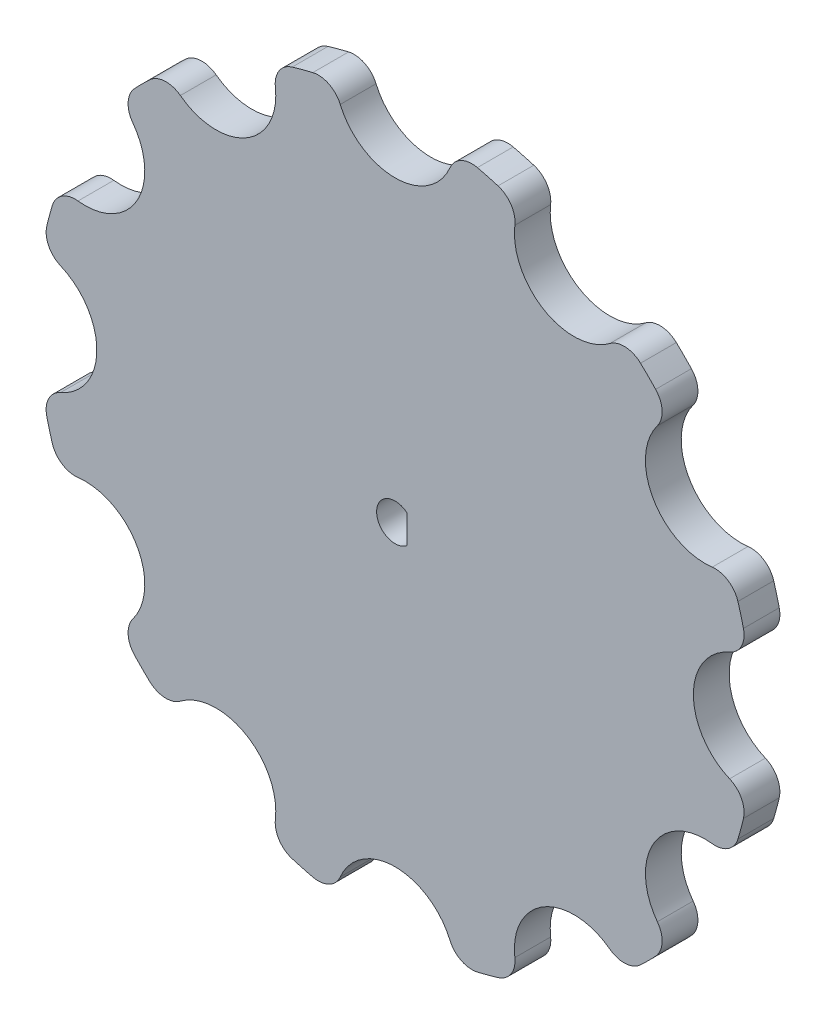
from build123d import *

# Parameters (mm, degrees)
BOSS_EXTRUDE1_DEPTH = 3
FILLET1_R           = 2
FILLET2_R           = 2
CUT_EXTRUDE1_DEPTH  = 10


with BuildPart() as part:
    # Sketch1 → Boss-Extrude1 (new body)
    with BuildSketch(Plane.XY):
        with BuildLine():
            ThreePointArc((29.583333333, -4.982608643), (25, 0), (29.583333333, 4.982608643))
            ThreePointArc((29.583333333, 4.982608643), (28.977774789, 7.764571353), (28.111222517, 10.476601005))
            ThreePointArc((28.111222517, 10.476601005), (21.650635095, 12.5), (23.128613874, 19.106732329))
            ThreePointArc((23.128613874, 19.106732329), (21.213203436, 21.213203436), (19.106732329, 23.128613874))
            ThreePointArc((19.106732329, 23.128613874), (12.5, 21.650635095), (10.476601005, 28.111222517))
            ThreePointArc((10.476601005, 28.111222517), (7.764571353, 28.977774789), (4.982608643, 29.583333333))
            ThreePointArc((4.982608643, 29.583333333), (0, 25), (-4.982608643, 29.583333333))
            ThreePointArc((-4.982608643, 29.583333333), (-7.764571353, 28.977774789), (-10.476601005, 28.111222517))
            ThreePointArc((-10.476601005, 28.111222517), (-10.120604803, 27.072321783), (-10, 25.980762114))
            ThreePointArc((-10, 25.980762114), (-13.505620805, 21.209302083), (-19.106732329, 23.128613874))
            ThreePointArc((-19.106732329, 23.128613874), (-21.213203436, 21.213203436), (-23.128613874, 19.106732329))
            ThreePointArc((-23.128613874, 19.106732329), (-21.550144707, 17.317246081), (-20.980762114, 15))
            ThreePointArc((-20.980762114, 15), (-23.302357926, 10.777897324), (-28.111222517, 10.476601005))
            ThreePointArc((-28.111222517, 10.476601005), (-28.977774789, 7.764571353), (-29.583333333, 4.982608643))
            ThreePointArc((-29.583333333, 4.982608643), (-26.320099639, 3.385016002), (-25, 0))
            ThreePointArc((-25, 0), (-26.320099639, -3.385016002), (-29.583333333, -4.982608643))
            ThreePointArc((-29.583333333, -4.982608643), (-28.977774789, -7.764571353), (-28.111222517, -10.476601005))
            ThreePointArc((-28.111222517, -10.476601005), (-23.302357926, -10.777897324), (-20.980762114, -15))
            ThreePointArc((-20.980762114, -15), (-21.550144707, -17.317246081), (-23.128613874, -19.106732329))
            ThreePointArc((-23.128613874, -19.106732329), (-21.213203436, -21.213203436), (-19.106732329, -23.128613874))
            ThreePointArc((-19.106732329, -23.128613874), (-13.505620805, -21.209302083), (-10, -25.980762114))
            ThreePointArc((-10, -25.980762114), (-10.120604803, -27.072321783), (-10.476601005, -28.111222517))
            ThreePointArc((-10.476601005, -28.111222517), (-7.764571353, -28.977774789), (-4.982608643, -29.583333333))
            ThreePointArc((-4.982608643, -29.583333333), (0, -25), (4.982608643, -29.583333333))
            ThreePointArc((4.982608643, -29.583333333), (7.764571353, -28.977774789), (10.476601005, -28.111222517))
            ThreePointArc((10.476601005, -28.111222517), (12.5, -21.650635095), (19.106732329, -23.128613874))
            ThreePointArc((19.106732329, -23.128613874), (21.213203436, -21.213203436), (23.128613874, -19.106732329))
            ThreePointArc((23.128613874, -19.106732329), (21.650635095, -12.5), (28.111222517, -10.476601005))
            ThreePointArc((28.111222517, -10.476601005), (28.977774789, -7.764571353), (29.583333333, -4.982608643))
        make_face()
    extrude(amount=BOSS_EXTRUDE1_DEPTH)

    # Fillet1
    fillet1_edges = [part.edges().sort_by_distance(p)[0] for p in [
        (-10.476601005, 28.111222517, 1.5),
        (-4.982608643, 29.583333333, 1.5),
        (-23.128613874, 19.106732329, 1.5),
        (-19.106732329, 23.128613874, 1.5),
    ]]
    fillet(fillet1_edges, radius=FILLET1_R)

    # Fillet2
    fillet2_edges = [part.edges().sort_by_distance(p)[0] for p in [
        (4.982608643, 29.583333333, 1.5),
        (10.476601005, 28.111222517, 1.5),
        (19.106732329, 23.128613874, 1.5),
        (23.128613874, 19.106732329, 1.5),
        (28.111222517, 10.476601005, 1.5),
        (29.583333333, 4.982608643, 1.5),
        (29.583333333, -4.982608643, 1.5),
        (28.111222517, -10.476601005, 1.5),
        (23.128613874, -19.106732329, 1.5),
        (19.106732329, -23.128613874, 1.5),
        (10.476601005, -28.111222517, 1.5),
        (4.982608643, -29.583333333, 1.5),
        (-4.982608643, -29.583333333, 1.5),
        (-10.476601005, -28.111222517, 1.5),
        (-19.106732329, -23.128613874, 1.5),
        (-23.128613874, -19.106732329, 1.5),
        (-28.111222517, -10.476601005, 1.5),
        (-29.583333333, -4.982608643, 1.5),
        (-29.583333333, 4.982608643, 1.5),
        (-28.111222517, 10.476601005, 1.5),
    ]]
    fillet(fillet2_edges, radius=FILLET2_R)

    # Sketch2 → Cut-Extrude1 (cut)
    with BuildSketch(Plane(origin=(0, 0, 0), x_dir=(-1, 0, 0), z_dir=(0, 0, -1))):
        with BuildLine():
            Line((-1, 1.184271928), (-1, 0))
            Line((-1, 0), (-1, -1.184271928))
            ThreePointArc((-1, -1.184271928), (0.652878243, -1.405791592), (1.55, 0))
            ThreePointArc((1.55, 0), (0.652878243, 1.405791592), (-1, 1.184271928))
        make_face()
    extrude(amount=-CUT_EXTRUDE1_DEPTH, mode=Mode.SUBTRACT)


solid = part.part
